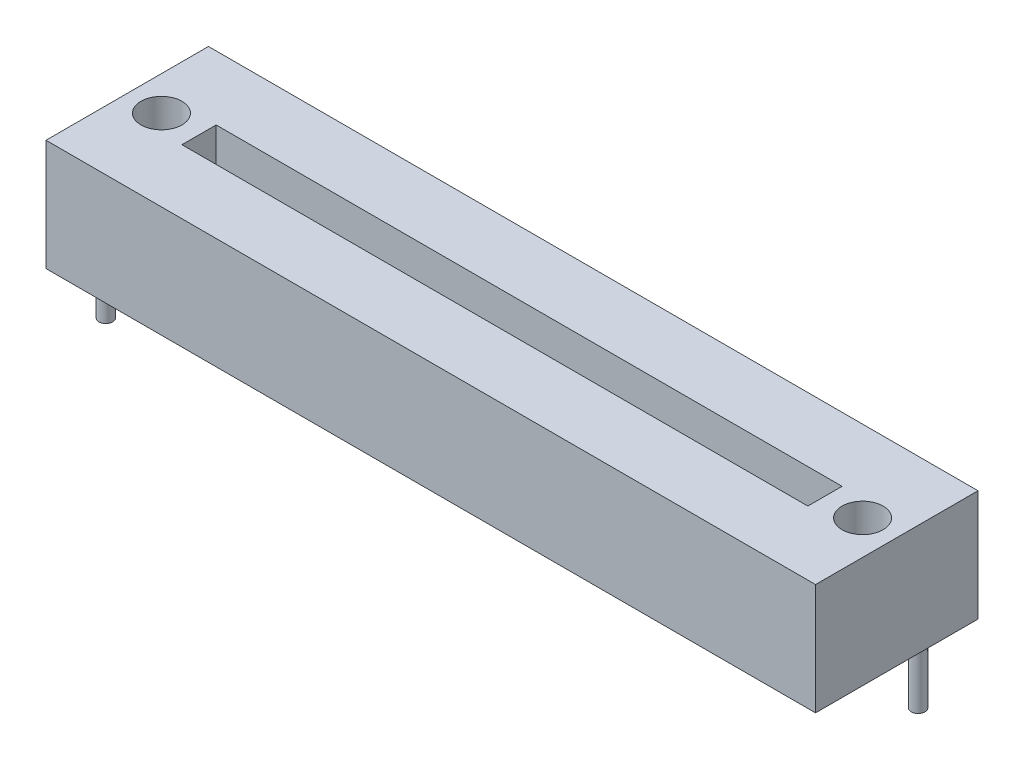
from build123d import *

# Parameters (mm, degrees)
SKETCH1_W            = 45
SKETCH1_H            = 9.5
SKETCH1_W_2          = 36.6
SKETCH1_H_2          = 2
BOSS_EXTRUDE1_DEPTH  = 6.5
SKETCH2_W            = 45
SKETCH2_H            = 9.5
BOSS_EXTRUDE2_DEPTH  = 2
M2_CLEARANCE_HOLE1_D = 2.4
SKETCH5_R            = 0.4
BOSS_EXTRUDE3_DEPTH  = 3.5


with BuildPart() as part:
    # Sketch1 → Boss-Extrude1 (new body)
    with BuildSketch(Plane(origin=(0, 0, 0), x_dir=(1, 0, 0), z_dir=(0, 1, 0))):
        Rectangle(SKETCH1_W, SKETCH1_H)
        Rectangle(SKETCH1_W_2, SKETCH1_H_2, mode=Mode.SUBTRACT)
    extrude(amount=BOSS_EXTRUDE1_DEPTH)

    # Sketch2 → Boss-Extrude2 (add)
    with BuildSketch(Plane.XZ):
        Rectangle(SKETCH2_W, SKETCH2_H)
    extrude(amount=-BOSS_EXTRUDE2_DEPTH)

    # M2 Clearance Hole1 (through all)
    with Locations(Plane(origin=(0, 6.5, 0), x_dir=(1, 0, 0), z_dir=(0, 1, 0))):
        with Locations((20.5, 0), (-20.5, 0)):
            Hole(M2_CLEARANCE_HOLE1_D / 2)

    # Sketch5 → Boss-Extrude3 (add)
    with BuildSketch(Plane.XZ):
        with Locations(Location((-21.75, 2, 0), (0, 0, 270))):
            Circle(SKETCH5_R)
        with Locations(Location((-21.75, -2, 0), (0, 0, 270))):
            Circle(SKETCH5_R)
        with Locations(Location((21.75, -2, 0), (0, 0, 270))):
            Circle(SKETCH5_R)
    extrude(amount=BOSS_EXTRUDE3_DEPTH)


solid = part.part
